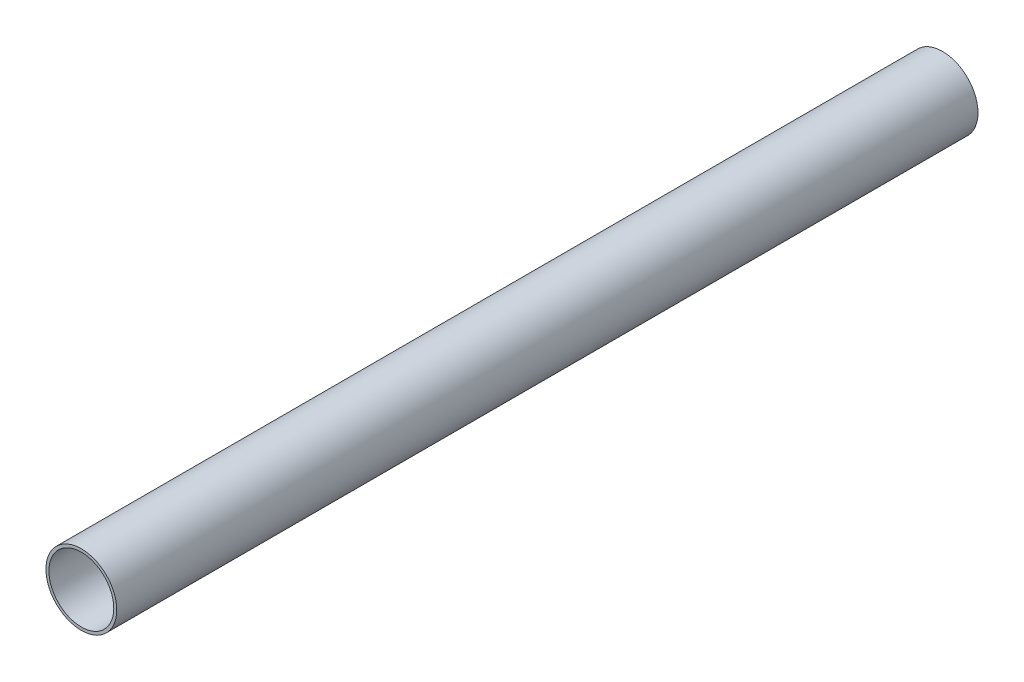
from build123d import *

# Parameters (mm, degrees)
MOTOR_CASING_R      = 19.05
MOTOR_CASING_R_2    = 17.4625
BOSS_EXTRUDE1_DEPTH = 463.55


with BuildPart() as part:
    # Motor Casing → Boss-Extrude1 (new body)
    with BuildSketch(Plane.XY):
        Circle(MOTOR_CASING_R)
        Circle(MOTOR_CASING_R_2, mode=Mode.SUBTRACT)
    extrude(amount=BOSS_EXTRUDE1_DEPTH)


solid = part.part
